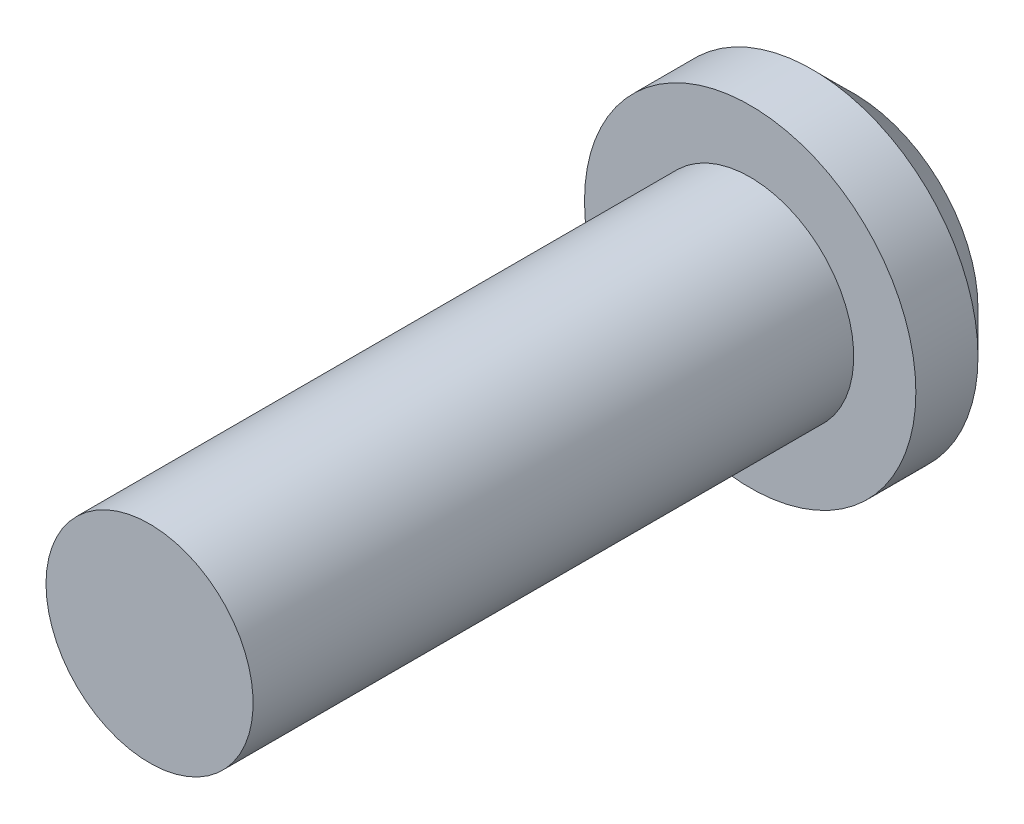
from build123d import *

# Parameters (mm, degrees)
SKETCH2_R           = 4
BOSS_EXTRUDE1_DEPTH = 2.5
SKETCH2_6_R         = 4
SKETCH2_6_R_2       = 2.5
BOSS_EXTRUDE2_DEPTH = 2.5
SKETCH3_R           = 2.5
BOSS_EXTRUDE3_DEPTH = 14.5
CHAMFER2_SIZE       = 1
CUT_EXTRUDE1_DEPTH  = 1.5


with BuildPart() as part:
    # Sketch2 → Boss-Extrude1 (new body)
    with BuildSketch(Plane.XY):
        Circle(SKETCH2_R)
    extrude(amount=BOSS_EXTRUDE1_DEPTH)

    # Sketch2<6> → Boss-Extrude2 (add)
    with BuildSketch(Plane.XY):
        Circle(SKETCH2_6_R)
        Circle(SKETCH2_6_R_2, mode=Mode.SUBTRACT)
    extrude(amount=BOSS_EXTRUDE2_DEPTH)

    # Sketch3 → Boss-Extrude3 (add)
    with BuildSketch(Plane.XY.offset(2.5)):
        with Locations(Location((0, 0, 0), (0, 0, 180))):
            Circle(SKETCH3_R)
    extrude(amount=BOSS_EXTRUDE3_DEPTH)

    # Chamfer2
    chamfer2_edges = [part.edges().sort_by_distance(p)[0] for p in [
        (-4, 0, 0),
    ]]
    chamfer(chamfer2_edges, length=CHAMFER2_SIZE)

    # Sketch4 → Cut-Extrude1 (cut)
    with BuildSketch(Plane(origin=(0, 0, 0), x_dir=(-1, 0, 0), z_dir=(0, 0, -1))):
        Polygon((-0.870420924, 2.834447623), (-2.889914109, 0.66341718), (-2.019493185, -2.171030443), (0.870420924, -2.834447623), (2.889914109, -0.66341718), (2.019493185, 2.171030443), align=None)
    extrude(amount=-CUT_EXTRUDE1_DEPTH, mode=Mode.SUBTRACT)


solid = part.part
